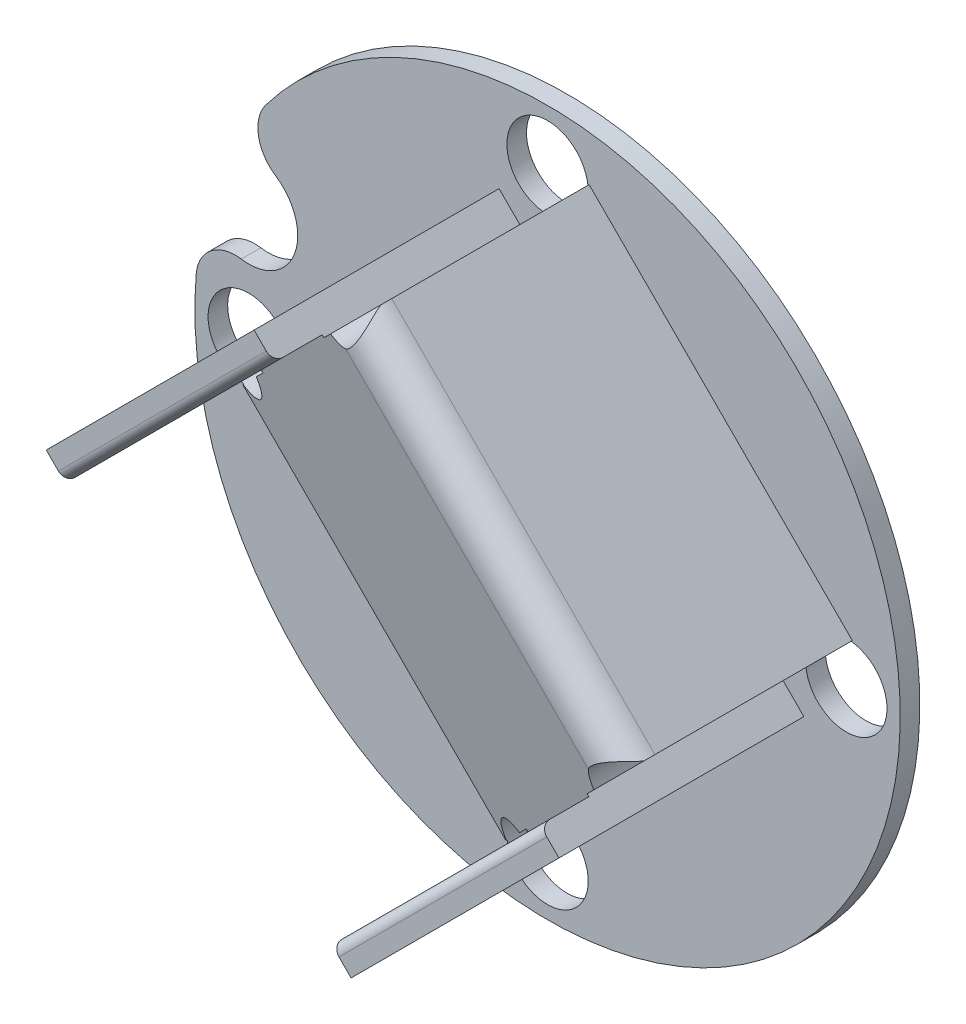
from build123d import *
from build123d.topology import SkipClean

# Parameters (mm, degrees)
SKETCH_1_R               = 36
SKETCH_1_R_2             = 4.15
EXTRUDE_1_DEPTH          = 2
SKETCH_2_W               = 45
SKETCH_2_H               = 45
EXTRUDE_2_DEPTH          = 25
SKETCH_3_R               = 36
SKETCH_3_R_2             = 4.15
EXTRUDE_3_DEPTH          = 2
EXTRUDE_4_DEPTH          = 25
CUT_EXTRUDE_1_DEPTH      = 50
EXTRUDE_6_DEPTH          = 25
CUT_EXTRUDE_3_DEPTH      = 38.25
CUT_EXTRUDE_3_DEPTH_BACK = 0.25
CUT_EXTRUDE_4_DEPTH      = 50
CUT_EXTRUDE_4_DEPTH_BACK = 4
SKETCH_20_W              = 45
SKETCH_20_H              = 45
EXTRUDE_7_DEPTH          = 13
FILLET_1_R               = 3
FILLET_2_R               = 1
SKETCH_22_R              = 36
CUT_EXTRUDE_6_DEPTH      = 40
SKETCH_24_R              = 5
CUT_EXTRUDE_7_DEPTH      = 2
FILLET_3_R               = 4


with BuildPart() as part:
    # 草图1 → 凸台-拉伸1 (new body)
    with BuildSketch(Plane.XY):
        Circle(SKETCH_1_R)
        with Locations((30.5, 0)):
            Circle(SKETCH_1_R_2, mode=Mode.SUBTRACT)
        with Locations((0, -30.5)):
            Circle(SKETCH_1_R_2, mode=Mode.SUBTRACT)
        with Locations((-30.5, 0)):
            Circle(SKETCH_1_R_2, mode=Mode.SUBTRACT)
        with Locations((0, 30.5)):
            Circle(SKETCH_1_R_2, mode=Mode.SUBTRACT)
    extrude(amount=EXTRUDE_1_DEPTH)

    # 草图2 → 凸台-拉伸2 (add)
    with BuildSketch(Plane.XY.offset(2)):
        Rectangle(SKETCH_2_W, SKETCH_2_H)
    extrude(amount=EXTRUDE_2_DEPTH)

    # 草图3 → 凸台-拉伸3 (add)
    with BuildSketch(Plane.XY.offset(27)):
        Circle(SKETCH_3_R)
        with Locations((0, 30.5)):
            Circle(SKETCH_3_R_2, mode=Mode.SUBTRACT)
        with Locations((0, -30.5)):
            Circle(SKETCH_3_R_2, mode=Mode.SUBTRACT)
        with Locations((-30.5, 0)):
            Circle(SKETCH_3_R_2, mode=Mode.SUBTRACT)
        with Locations((30.5, 0)):
            Circle(SKETCH_3_R_2, mode=Mode.SUBTRACT)
    extrude(amount=EXTRUDE_3_DEPTH)

    # 草图8 → 凸台-拉伸4 (add)
    with SkipClean():  # the faces are left unmerged after this step: merging them gives an invalid solid
        with BuildSketch(Plane.XY.offset(29)):
            with BuildLine():
                Line((-31.112698372, -4.242640687), (-4.242640687, -31.112698372))
                Line((-4.242640687, -31.112698372), (-4.120861375, -30.990919061))
                ThreePointArc((-4.120861375, -30.990919061), (-2.934493142, -27.565506858), (0.490919061, -26.379138625))
                Line((0.490919061, -26.379138625), (26.379138625, -0.490919061))
                ThreePointArc((26.379138625, -0.490919061), (27.565506858, 2.934493142), (30.990919061, 4.120861375))
                Line((30.990919061, 4.120861375), (31.112698372, 4.242640687))
                Line((31.112698372, 4.242640687), (4.242640687, 31.112698372))
                Line((4.242640687, 31.112698372), (4.120861375, 30.990919061))
                ThreePointArc((4.120861375, 30.990919061), (2.934493142, 27.565506858), (-0.490919061, 26.379138625))
                Line((-0.490919061, 26.379138625), (-26.379138625, 0.490919061))
                ThreePointArc((-26.379138625, 0.490919061), (-27.565506858, -2.934493142), (-30.990919061, -4.120861375))
                Line((-30.990919061, -4.120861375), (-31.112698372, -4.242640687))
            make_face()
        extrude(amount=EXTRUDE_4_DEPTH)

    # 草图12 → 切除-拉伸1 (cut)
    with BuildSketch(Plane(origin=(13.435028843, -13.435028843, 0), x_dir=(0, 0, -1), z_dir=(0.7071067811865477, -0.7071067811865474, 0))):
        Polygon((-54, 25), (-54, -25), (-29, -25), align=None)
    extrude(amount=-CUT_EXTRUDE_1_DEPTH, mode=Mode.SUBTRACT)

    # 草图16 → 凸台-拉伸6 (add)
    with SkipClean():  # the faces are left unmerged after this step: merging them gives an invalid solid
        with BuildSketch(Plane.XY.offset(29)):
            Polygon((-24.04163056, 2.828427125), (-2.828427125, 24.04163056), (-4.949747468, 26.162950904), (-26.162950904, 4.949747468), align=None)
            Polygon((24.04163056, -2.828427125), (2.828427125, -24.04163056), (4.949747468, -26.162950904), (26.162950904, -4.949747468), align=None)
        extrude(amount=EXTRUDE_6_DEPTH)

    # 草图17 → 切除-拉伸3 (cut, two sides: drawn at the far end of the back side and taken through both)
    with SkipClean():  # the faces are left unmerged after this step: merging them gives an invalid solid
        with BuildSketch(Plane(origin=(-13.435028843, 13.435028843, 0), x_dir=(0, 0, -1), z_dir=(0.7071067811865477, -0.7071067811865474, 0)).offset(-CUT_EXTRUDE_3_DEPTH_BACK)):
            Polygon((-49, 15), (-34, -15), (-54, -15), (-54, 15), align=None)
        extrude(amount=CUT_EXTRUDE_3_DEPTH + CUT_EXTRUDE_3_DEPTH_BACK, mode=Mode.SUBTRACT)

    # 草图18 → 切除-拉伸4 (cut, two sides: drawn at the far end of the back side and taken through both)
    with SkipClean():  # the faces are left unmerged after this step: merging them gives an invalid solid
        with BuildSketch(Plane(origin=(-13.611805538, 13.611805538, 0), x_dir=(0, 0, -1), z_dir=(0.7071067811865477, -0.7071067811865474, 0)).offset(-CUT_EXTRUDE_4_DEPTH_BACK)):
            Polygon((-44.201018115, 13.183932796), (-32.573464632, -10.07117417), (-29, -8.284441854), (-40.83096799, 14.868957859), align=None)
        extrude(amount=CUT_EXTRUDE_4_DEPTH + CUT_EXTRUDE_4_DEPTH_BACK, mode=Mode.SUBTRACT)

    # 草图20 → 凸台-拉伸7 (add)
    with SkipClean():  # the faces are left unmerged after this step: merging them gives an invalid solid
        with BuildSketch(Plane(origin=(0, 0, 0), x_dir=(-1, 0, 0), z_dir=(0, 0, -1))):
            Rectangle(SKETCH_20_W, SKETCH_20_H)
        extrude(amount=EXTRUDE_7_DEPTH)

    # 圆角1
    fillet_1_edges = [part.edges().sort_by_distance(p)[0] for p in [
        (17.67766953, 17.67766953, 54),
    ]]
    fillet(fillet_1_edges, radius=FILLET_1_R)

    # 圆角2
    fillet_2_edges = [part.edges().sort_by_distance(p)[0] for p in [
        (13.611805538, -13.611805538, 54),
        (-13.611805538, 13.611805538, 54),
    ]]
    fillet(fillet_2_edges, radius=FILLET_2_R)

    # 草图22 → 切除-拉伸6 (cut)
    with SkipClean():  # the faces are left unmerged after this step: merging them gives an invalid solid
        with BuildSketch(Plane(origin=(0, 0, -13), x_dir=(-1, 0, 0), z_dir=(0, 0, -1))):
            Circle(SKETCH_22_R)
        extrude(amount=-CUT_EXTRUDE_6_DEPTH, mode=Mode.SUBTRACT)

    # 草图24 → 切除-拉伸7 (cut)
    with SkipClean():  # the faces are left unmerged after this step: merging them gives an invalid solid
        with BuildSketch(Plane(origin=(0, 0, 27), x_dir=(-1, 0, 0), z_dir=(0, 0, -1))):
            with Locations((30.5, 11.72)):
                Circle(SKETCH_24_R)
        extrude(amount=-CUT_EXTRUDE_7_DEPTH, mode=Mode.SUBTRACT)

    # 圆角3
    fillet_3_edges = [part.edges().sort_by_distance(p)[0] for p in [
        (-34.808921563, 9.183625626, 28),
        (-32.001676968, 16.489168301, 28),
    ]]
    fillet(fillet_3_edges, radius=FILLET_3_R)


solid = part.part
